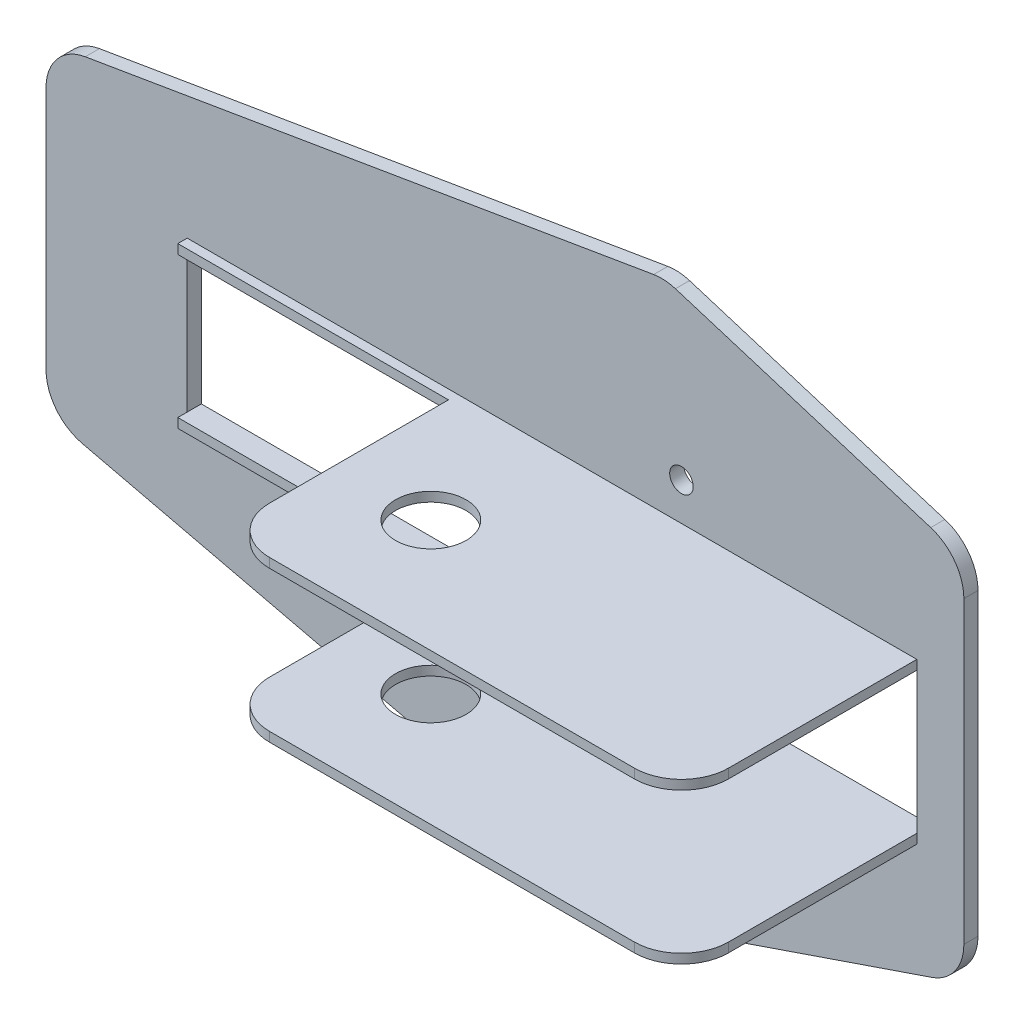
from build123d import *

# Parameters (mm, degrees)
SZKIC1_W                    = 260
SZKIC1_H                    = 150
DODANIE_WYCI_GNI_CIE1_DEPTH = 3
SZKIC2_R                    = 2.5
SZKIC2_W                    = 155
SZKIC2_H                    = 30
WYTNIJ_WYCI_GNI_CIE1_DEPTH  = 3
WYTNIJ_WYCI_GNI_CIE3_DEPTH  = 3
SZKIC6_W                    = 155
SZKIC6_H                    = 2
DODANIE_WYCI_GNI_CIE2_DEPTH = 5
SZKIC7_W                    = 77.5
SZKIC7_H                    = 2
DODANIE_WYCI_GNI_CIE3_DEPTH = 48
SZKIC10_W                   = 20
SZKIC10_H                   = 48
DODANIE_WYCI_GNI_CIE5_DEPTH = 2
SZKIC12_R                   = 7.5
WYTNIJ_WYCI_GNI_CIE4_DEPTH  = 40
ZAOKR_GLENIE1_R             = 10


with BuildPart() as part:
    # Szkic1 → Dodanie-wyciągnięcie1 (new body)
    with BuildSketch(Plane.XY):
        Rectangle(SZKIC1_W, SZKIC1_H)
    extrude(amount=DODANIE_WYCI_GNI_CIE1_DEPTH)

    # Szkic2 → Wytnij-wyciągnięcie1 (cut)
    with BuildSketch(Plane.XY.offset(3)):
        with Locations((70, 25)):
            Circle(SZKIC2_R)
        with Locations((70, -25)):
            Circle(SZKIC2_R)
        with Locations((42.5, 0)):
            Rectangle(SZKIC2_W, SZKIC2_H)
    extrude(amount=-WYTNIJ_WYCI_GNI_CIE1_DEPTH, mode=Mode.SUBTRACT)

    # Szkic4 → Wytnij-wyciągnięcie3 (cut)
    with BuildSketch(Plane(origin=(0, 0, 0), x_dir=(-1, 0, 0), z_dir=(0, 0, -1))):
        with BuildLine():
            ThreePointArc((-123.23193039, -39.89969852), (-128.133858368, -36.253613669), (-130, -30.436367925))
            Line((-130, -30.436367925), (-130, -75))
            Line((-130, -75), (130, -75))
            Line((130, -75), (130, 75))
            Line((130, 75), (-130, 75))
            Line((-130, 75), (-130, 33.178745855))
            ThreePointArc((-130, 33.178745855), (-128.050508227, 39.11080429), (-122.962136544, 42.729962902))
            Line((-122.962136544, 42.729962902), (-68.723094228, 59.551217048))
            ThreePointArc((-68.723094228, 59.551217048), (-66.430659203, 59.977549793), (-64.101812385, 59.861401365))
            Line((-64.101812385, 59.861401365), (56.659145299, 39.543804725))
            ThreePointArc((56.659145299, 39.543804725), (62.635163816, 36.140287961), (65, 29.682403361))
            Line((65, 29.682403361), (65, -22.197400037))
            ThreePointArc((65, -22.197400037), (62.841744534, -28.402804348), (57.298591466, -31.929639105))
            Line((57.298591466, -31.929639105), (-60.417650648, -59.732239068))
            ThreePointArc((-60.417650648, -59.732239068), (-63.201894591, -59.988200122), (-65.948172504, -59.463330595))
            Line((-65.948172504, -59.463330595), (-123.23193039, -39.89969852))
        make_face()
    extrude(amount=-WYTNIJ_WYCI_GNI_CIE3_DEPTH, mode=Mode.SUBTRACT)

    # Szkic6 → Dodanie-wyciągnięcie2 (add)
    with BuildSketch(Plane(origin=(0, 0, 0), x_dir=(-1, 0, 0), z_dir=(0, 0, -1))):
        with Locations((-42.5, 16)):
            Rectangle(SZKIC6_W, SZKIC6_H)
        with Locations((-42.5, -16)):
            Rectangle(SZKIC6_W, SZKIC6_H)
    extrude(amount=-DODANIE_WYCI_GNI_CIE2_DEPTH)

    # Szkic7 → Dodanie-wyciągnięcie3 (add)
    with BuildSketch(Plane.XY.offset(5)):
        with Locations((81.25, 16)):
            Rectangle(SZKIC7_W, SZKIC7_H)
    dodanie_wyci_gni_cie3 = extrude(amount=DODANIE_WYCI_GNI_CIE3_DEPTH)

    # Lustro2: Dodanie-wyciągnięcie3 across plane
    add(dodanie_wyci_gni_cie3.mirror(Plane.ZX))

    # Szkic10 → Dodanie-wyciągnięcie5 (add)
    with BuildSketch(Plane.XZ.offset(17)):
        with Locations((32.5, 29)):
            Rectangle(SZKIC10_W, SZKIC10_H)
    dodanie_wyci_gni_cie5 = extrude(amount=-DODANIE_WYCI_GNI_CIE5_DEPTH)

    # Lustro3: Dodanie-wyciągnięcie5 across plane
    add(dodanie_wyci_gni_cie5.mirror(Plane.ZX))

    # Szkic12 → Wytnij-wyciągnięcie4 (cut)
    with BuildSketch(Plane(origin=(0, -17, 0), x_dir=(-1, 0, 0), z_dir=(0, -1, 0))):
        with Locations(Location((-42.75, -29, 0), (0, 0, 180))):
            Circle(SZKIC12_R)
    extrude(amount=-WYTNIJ_WYCI_GNI_CIE4_DEPTH, mode=Mode.SUBTRACT)

    # Zaokrąglenie1
    zaokr_glenie1_edges = [part.edges().sort_by_distance(p)[0] for p in [
        (120, 16, 53),
        (120, -16, 53),
        (22.5, -16, 53),
        (22.5, 16, 53),
    ]]
    fillet(zaokr_glenie1_edges, radius=ZAOKR_GLENIE1_R)


solid = part.part
